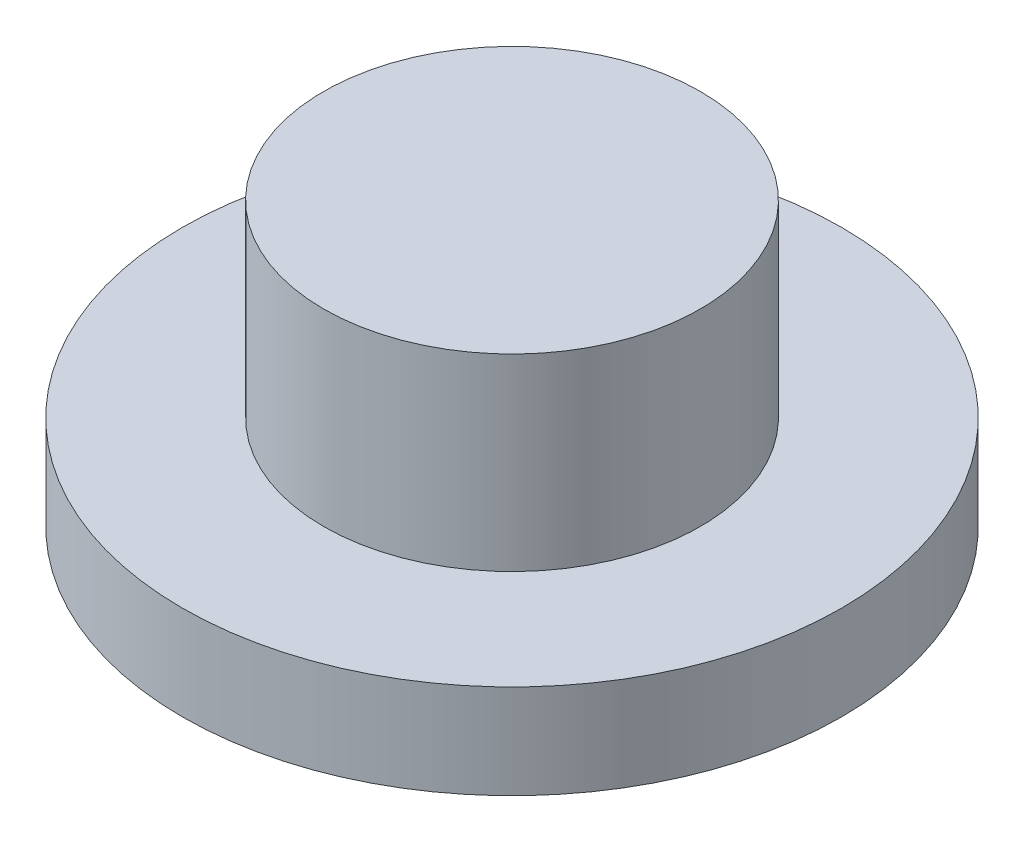
from build123d import *

# Parameters (mm, degrees)
SKETCH1_R           = 35
BOSS_EXTRUDE1_DEPTH = 10
SKETCH2_R           = 20
BOSS_EXTRUDE2_DEPTH = 20


with BuildPart() as part:
    # Sketch1 → Boss-Extrude1 (new body)
    with BuildSketch(Plane(origin=(0, 0, 0), x_dir=(1, 0, 0), z_dir=(0, 1, 0))):
        with Locations(Location((0, 0, 0), (0, 0, 270))):
            Circle(SKETCH1_R)
    extrude(amount=BOSS_EXTRUDE1_DEPTH)

    # Sketch2 → Boss-Extrude2 (add)
    with BuildSketch(Plane(origin=(0, 10, 0), x_dir=(1, 0, 0), z_dir=(0, 1, 0))):
        with Locations(Location((0, 0, 0), (0, 0, 270))):
            Circle(SKETCH2_R)
    extrude(amount=BOSS_EXTRUDE2_DEPTH)


solid = part.part
